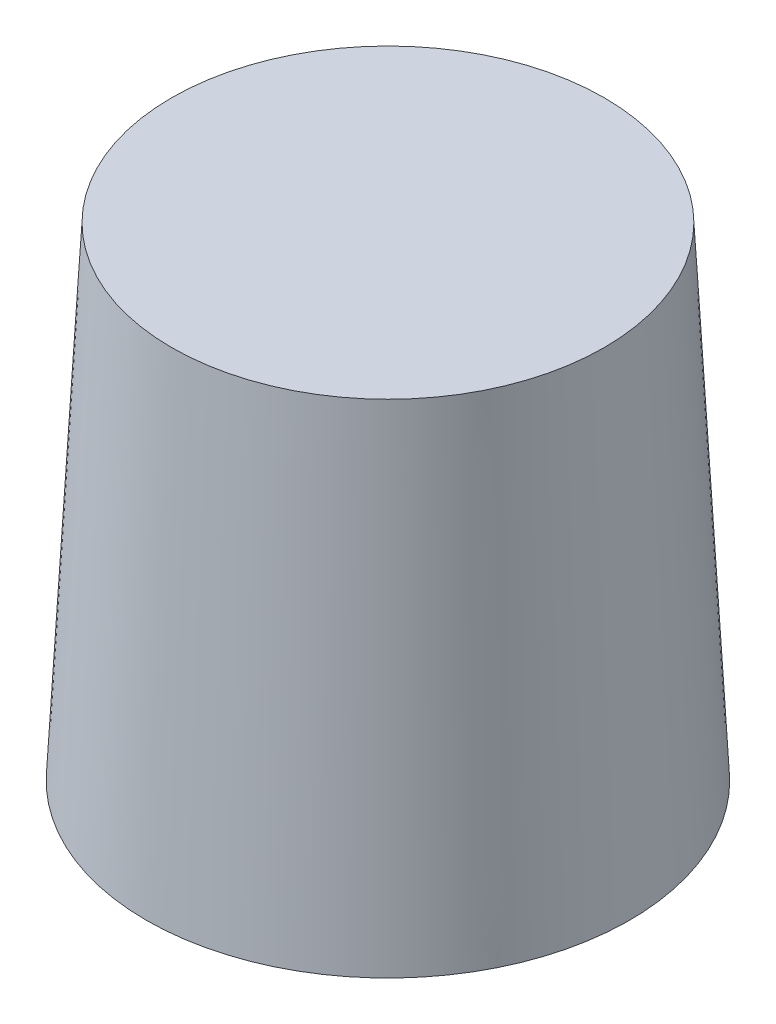
from build123d import *

# Parameters (mm, degrees)
SKETCH1_R           = 10
BOSS_EXTRUDE1_DEPTH = 20
BOSS_EXTRUDE1_TAPER = 3
SKETCH2_R           = 5
CUT_EXTRUDE1_DEPTH  = 4
CUT_EXTRUDE2_DEPTH  = 12
CHAMFER1_SIZE       = 1
CHAMFER1_SIZE2      = 0.577350269


with BuildPart() as part:
    # Sketch1 → Boss-Extrude1 (new body)
    with BuildSketch(Plane(origin=(0, 0, 0), x_dir=(1, 0, 0), z_dir=(0, 1, 0))):
        Circle(SKETCH1_R)
    extrude(amount=BOSS_EXTRUDE1_DEPTH, taper=BOSS_EXTRUDE1_TAPER)

    # Sketch2 → Cut-Extrude1 (cut)
    with BuildSketch(Plane.XZ):
        with Locations(Location((0, 0, 0), (0, 0, 270))):
            Circle(SKETCH2_R)
    extrude(amount=-CUT_EXTRUDE1_DEPTH, mode=Mode.SUBTRACT)

    # Sketch3 → Cut-Extrude2 (cut)
    with BuildSketch(Plane.XZ.offset(-4)):
        with BuildLine():
            Line((-1.732055507, -2.57098886), (3.04828024, -0.563903873))
            ThreePointArc((3.04828024, -0.563903873), (-1.200087257, 2.858284551), (-1.732055507, -2.57098886))
        make_face()
    extrude(amount=-CUT_EXTRUDE2_DEPTH, mode=Mode.SUBTRACT)

    # Chamfer1
    chamfer1_edges = [part.edges().sort_by_distance(p)[0] for p in [
        (0, 0, 5),
    ]]
    chamfer1_side = [part.faces().sort_by_distance(p)[0] for p in [
        (0, 2, 5),
    ]]
    chamfer(chamfer1_edges, length=CHAMFER1_SIZE, length2=CHAMFER1_SIZE2, reference=chamfer1_side[0])


solid = part.part
